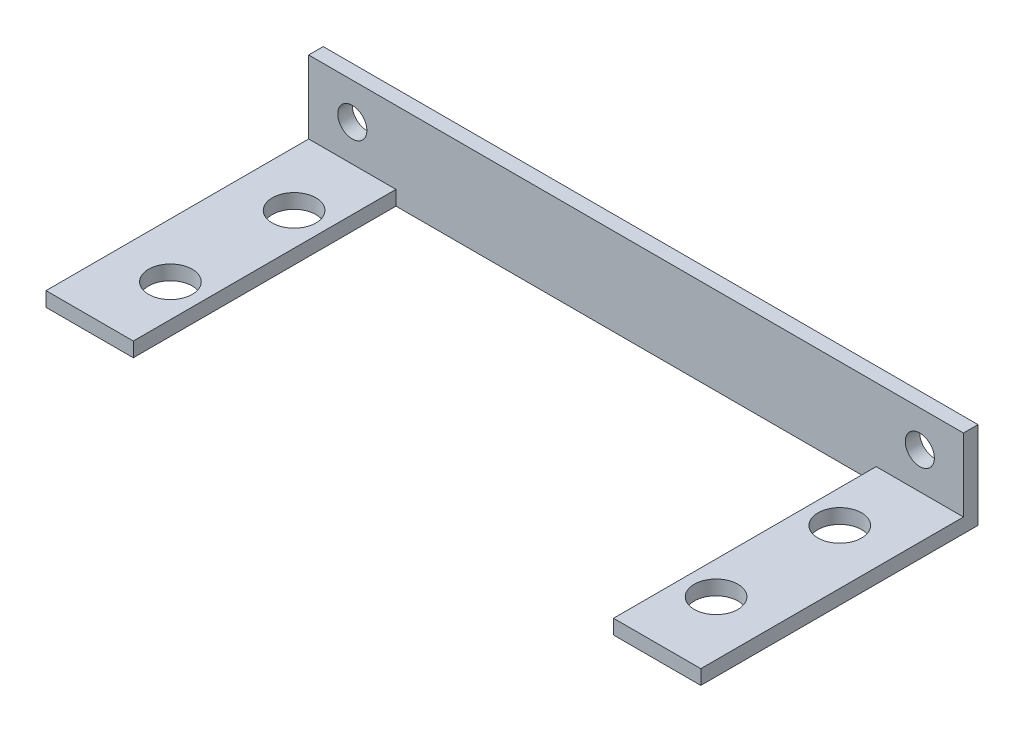
from build123d import *

# Parameters (mm, degrees)
BOSS_EXTRUDE1_DEPTH     = 45
SKETCH2_R               = 3
SKETCH2_W               = 66
SKETCH2_H               = 48.8
CUT_EXTRUDE1_DEPTH      = 60.804765696
CUT_EXTRUDE2_DEPTH      = 59.92546139
CUT_EXTRUDE2_DEPTH_BACK = 59.92546139
SKETCH3_R               = 2


with BuildPart() as part:
    # Sketch1 → Boss-Extrude1 (new, symmetric)
    with BuildSketch(Plane(origin=(0, 0, 0), x_dir=(0, 0, -1), z_dir=(1, 0, 0))):
        Polygon((-38.1, 0), (0, 0), (0, 12), (-2, 12), (-2, 2), (-38.1, 2), align=None)
    extrude(amount=BOSS_EXTRUDE1_DEPTH, both=True)

    # Sketch2 → Cut-Extrude1 (cut, through all)
    with BuildSketch(Plane(origin=(0, 2, 0), x_dir=(1, 0, 0), z_dir=(0, 1, 0))):
        with Locations(Location((37.5, -11.5, 0), (0, 0, 270))):
            Circle(SKETCH2_R)
        with Locations(Location((37.5, -28.5, 0), (0, 0, 90))):
            Circle(SKETCH2_R)
        with Locations(Location((-37.5, -11.5, 0), (0, 0, 90))):
            Circle(SKETCH2_R)
        with Locations(Location((-37.5, -28.5, 0), (0, 0, 270))):
            Circle(SKETCH2_R)
        with Locations((0, -26.4)):
            Rectangle(SKETCH2_W, SKETCH2_H)
    extrude(amount=-CUT_EXTRUDE1_DEPTH, mode=Mode.SUBTRACT)

    # Sketch3 → Cut-Extrude2 (cut, two sides: drawn at the far end of the back side and taken through both)
    with BuildSketch(Plane.XY.offset(2).offset(-CUT_EXTRUDE2_DEPTH_BACK)):
        with Locations((-39, 7)):
            Circle(SKETCH3_R)
        with Locations(Location((39, 7, 0), (0, 0, 90))):
            Circle(SKETCH3_R)
    extrude(amount=CUT_EXTRUDE2_DEPTH + CUT_EXTRUDE2_DEPTH_BACK, mode=Mode.SUBTRACT)


solid = part.part
